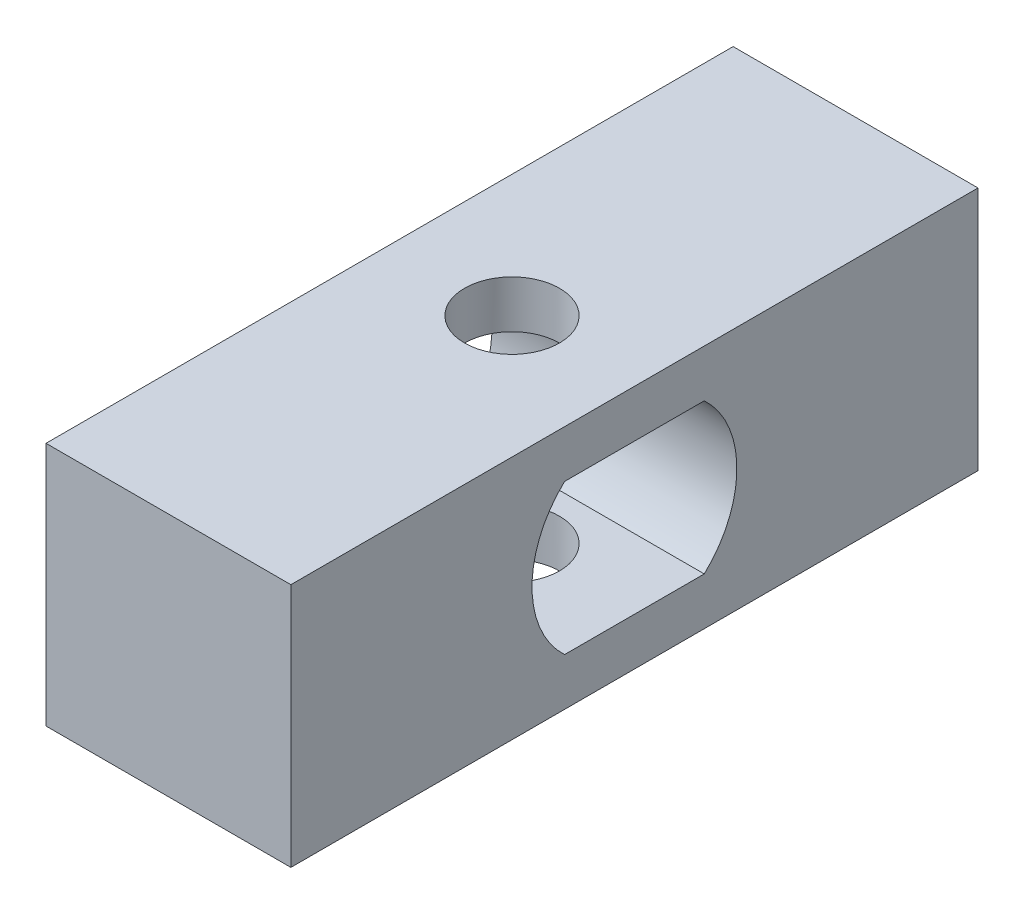
from build123d import *

# Parameters (mm, degrees)
SKETCH1_W           = 12.446
SKETCH1_H           = 12.446
BOSS_EXTRUDE1_DEPTH = 17.4625
SKETCH2_W           = 7.098379816
SKETCH2_H           = 7.62
CUT_EXTRUDE1_DEPTH  = 23.328626273
SKETCH3_R           = 2.413
CUT_EXTRUDE2_DEPTH  = 23.328626273


with BuildPart() as part:
    # Sketch1 → Boss-Extrude1 (new, symmetric)
    with BuildSketch(Plane.XY):
        Rectangle(SKETCH1_W, SKETCH1_H)
    extrude(amount=BOSS_EXTRUDE1_DEPTH, both=True)

    # Sketch2 → Cut-Extrude1 (cut, through all)
    with BuildSketch(Plane(origin=(6.223, 0, 0), x_dir=(0, 0, -1), z_dir=(1, 0, 0))):
        with BuildLine():
            ThreePointArc((-3.549189908, 3.81), (-5.207, 0), (-3.549189908, -3.81))
            Line((-3.549189908, -3.81), (-3.549189908, 3.81))
        make_face()
        Rectangle(SKETCH2_W, SKETCH2_H)
        with BuildLine():
            Line((3.549189908, 3.81), (3.549189908, -3.81))
            ThreePointArc((3.549189908, -3.81), (4.774593221, -2.077524627), (5.207, 0))
            ThreePointArc((5.207, 0), (4.774593221, 2.077524627), (3.549189908, 3.81))
        make_face()
    extrude(amount=-CUT_EXTRUDE1_DEPTH, mode=Mode.SUBTRACT)

    # Sketch3 → Cut-Extrude2 (cut, through all)
    with BuildSketch(Plane(origin=(0, 6.223, 0), x_dir=(1, 0, 0), z_dir=(0, 1, 0))):
        with Locations(Location((0, 0, 0), (0, 0, 270))):
            Circle(SKETCH3_R)
    extrude(amount=-CUT_EXTRUDE2_DEPTH, mode=Mode.SUBTRACT)


solid = part.part
